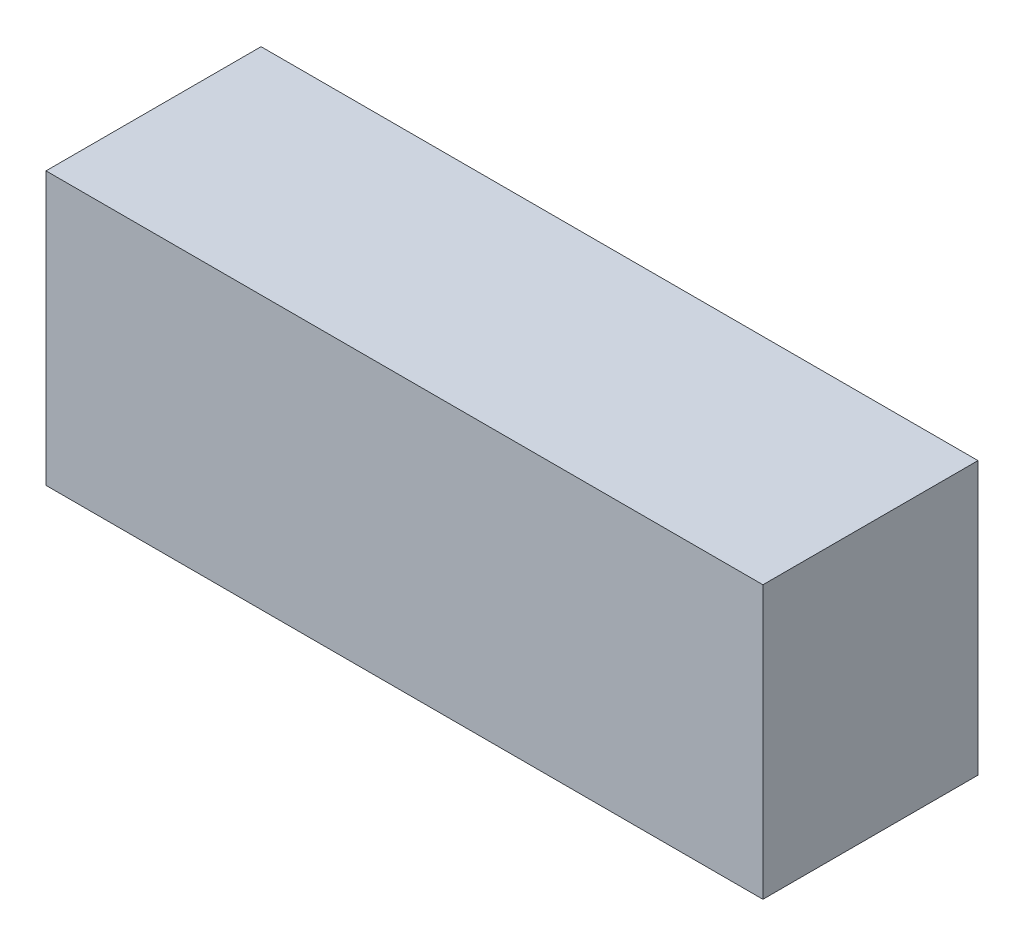
from build123d import *

# Parameters (mm, degrees)
SKETCH1_W           = 30
SKETCH1_H           = 9
BOSS_EXTRUDE1_DEPTH = 11.4


with BuildPart() as part:
    # Sketch1 → Boss-Extrude1 (new body)
    with BuildSketch(Plane(origin=(0, 0, 0), x_dir=(1, 0, 0), z_dir=(0, 1, 0))):
        with Locations((-0.595890411, -1.140410959)):
            Rectangle(SKETCH1_W, SKETCH1_H)
    extrude(amount=BOSS_EXTRUDE1_DEPTH)


solid = part.part
